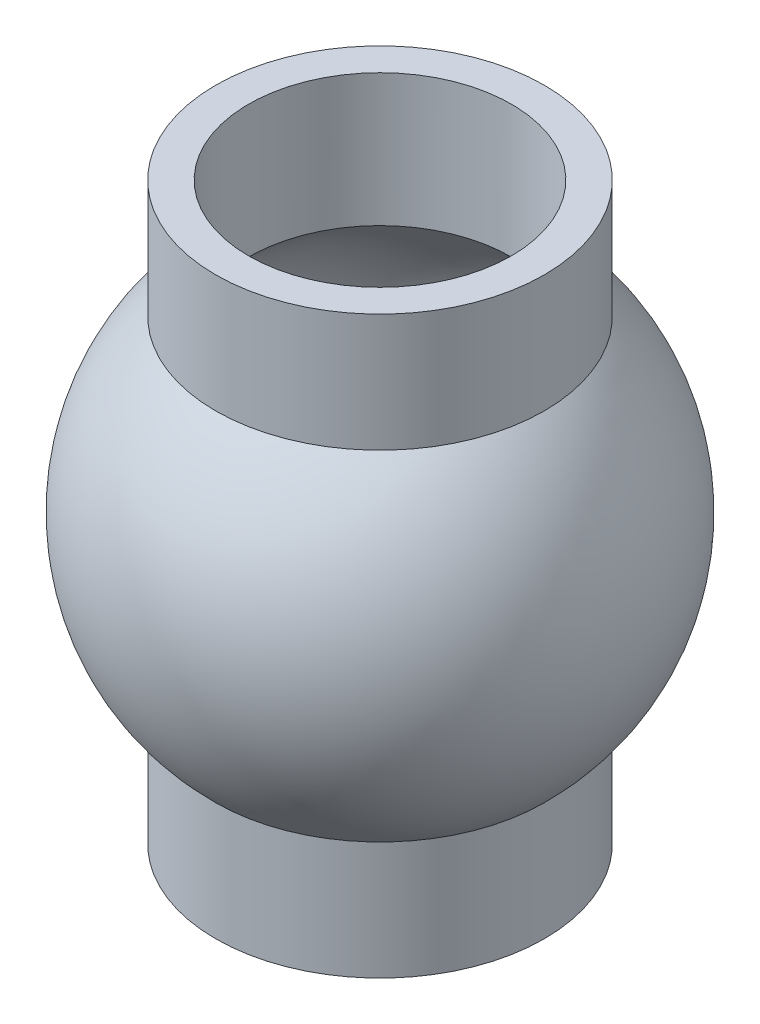
from build123d import *

# Parameters (mm, degrees)
SKETCH2_R           = 2
BOSS_EXTRUDE1_DEPTH = 3.5
SHELL1_T            = -0.4


with BuildPart() as part:
    # Sketch1 → Revolve1 (revolve)
    with BuildSketch(Plane.XY):
        with BuildLine():
            Line((0, -2.875), (0, 2.875))
            ThreePointArc((0, 2.875), (-2.875, 0), (0, -2.875))
        make_face()
    revolve(axis=Axis((0, 55, 0), (0, -1, 0)))

    # Sketch2 → Boss-Extrude1 (add, symmetric)
    with BuildSketch(Plane(origin=(0, 0, 0), x_dir=(1, 0, 0), z_dir=(0, 1, 0))):
        Circle(SKETCH2_R)
    extrude(amount=BOSS_EXTRUDE1_DEPTH, both=True)

    # Shell1
    shell1_openings = [part.faces().sort_by_distance(p)[0] for p in [
        (0, 3.5, 0),
        (0, -3.5, 0),
    ]]
    offset(amount=SHELL1_T, openings=shell1_openings, kind=Kind.INTERSECTION)


solid = part.part
